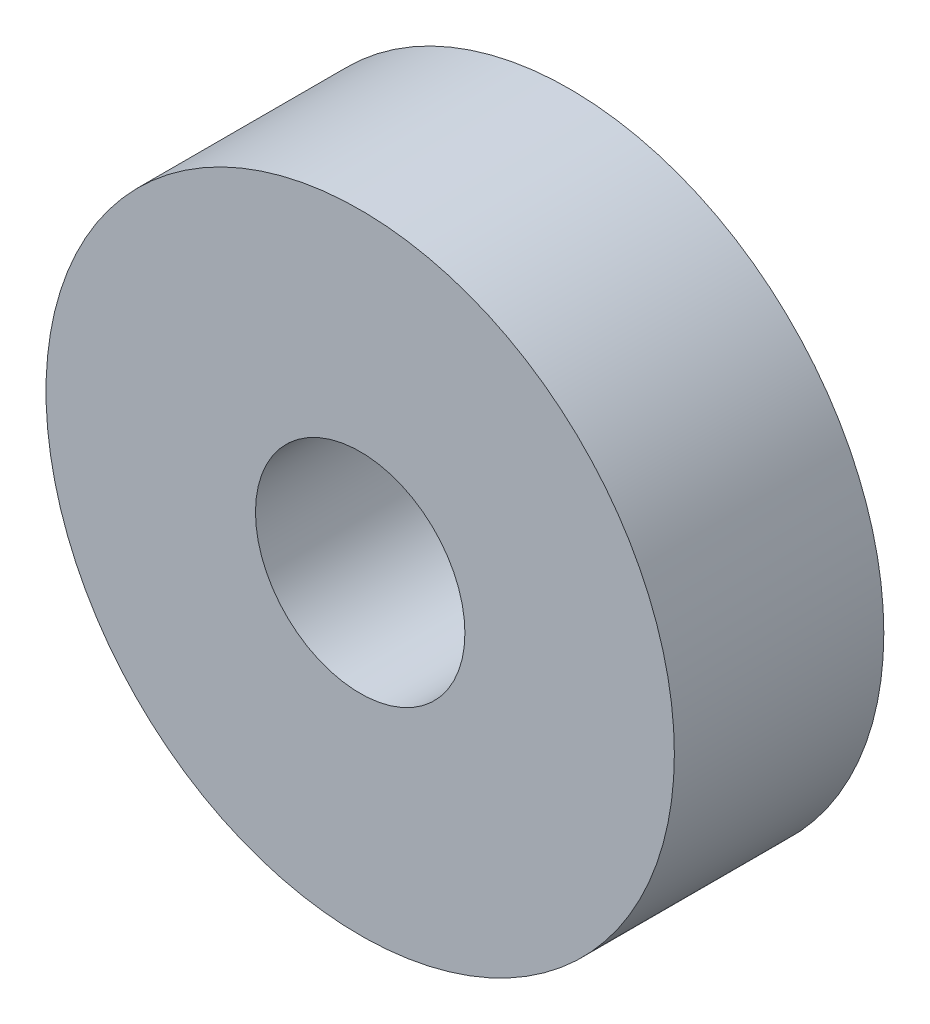
from build123d import *

# Parameters (mm, degrees)
BEARINGSKE_R   = 1.5
BEARINGSKE_R_2 = 0.5
BEARING_DEPTH  = 1


with BuildPart() as part:
    # BearingSke → Bearing (new body)
    with BuildSketch(Plane.XY):
        Circle(BEARINGSKE_R)
        Circle(BEARINGSKE_R_2, mode=Mode.SUBTRACT)
    extrude(amount=BEARING_DEPTH)


solid = part.part
